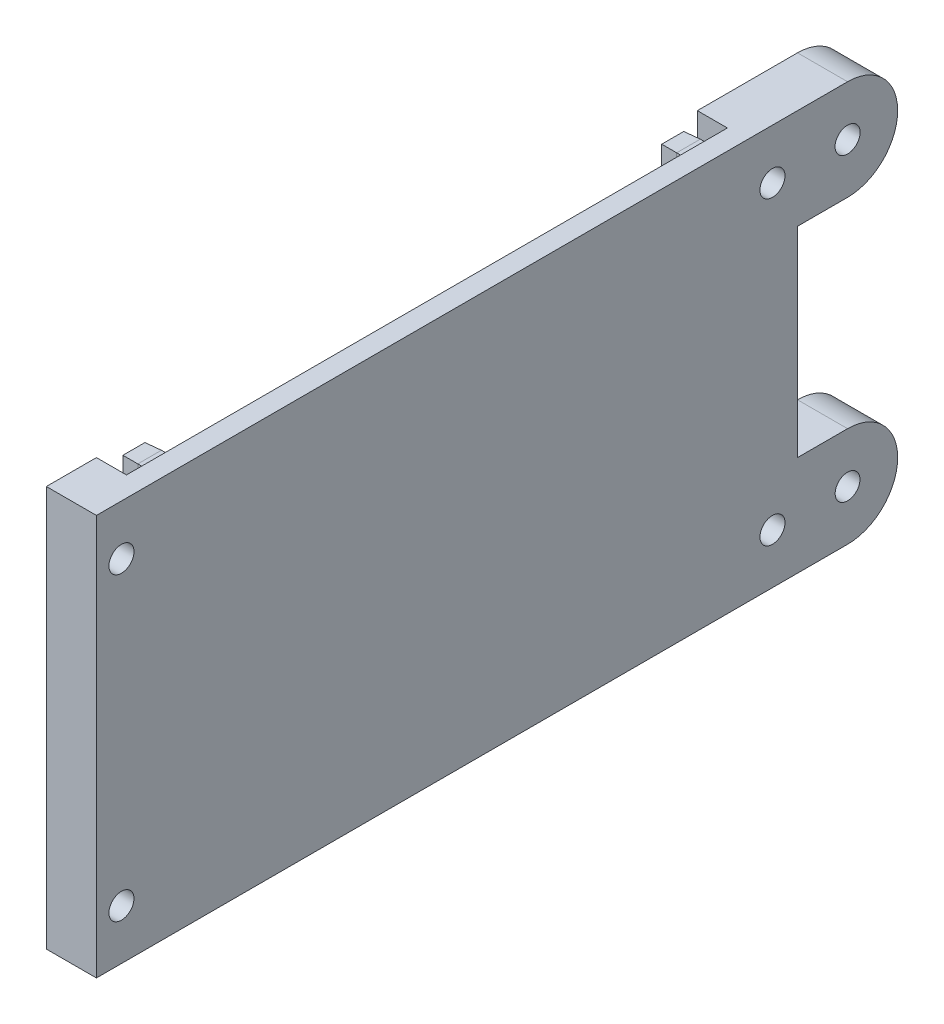
from build123d import *

# Parameters (mm, degrees)
SKETCH1_W            = 81.28
SKETCH1_H            = 81.28
SKETCH1_W_2          = 76.2
SKETCH1_H_2          = 76.2
BOSS_EXTRUDE1_DEPTH  = 50.8
SKETCH2_W            = 3.81
SKETCH2_H            = 76.2
BOSS_EXTRUDE2_DEPTH  = 2.54
SKETCH3_R            = 1.5748
BOSS_EXTRUDE3_DEPTH  = 6.35
SKETCH4_R            = 1.5875
BOSS_EXTRUDE4_DEPTH  = 6.35
SKETCH6_W            = 74.93
SKETCH6_H            = 50.8
CUT_EXTRUDE1_DEPTH   = 118.45268707
SKETCH7_W            = 2.9972
SKETCH7_H            = 6.35
BOSS_EXTRUDE5_DEPTH  = 1.00076
SKETCH8_W            = 2.9972
SKETCH8_H            = 6.35
BOSS_EXTRUDE6_DEPTH  = 1.99898
BOSS_EXTRUDE6_TAPER  = 3
LPATTERN1_COUNT      = 4
LPATTERN1_PITCH      = 12.7
LPATTERN1_COUNT_DIR2 = 2
LPATTERN1_PITCH_DIR2 = 68.326
SKETCH9_W            = 6.35
SKETCH9_H            = 50.8
BOSS_EXTRUDE7_DEPTH  = 3.81
SKETCH10_R           = 1.5875
CUT_EXTRUDE2_DEPTH   = 77.727341932
SKETCH12_W           = 4.993400043
SKETCH12_H           = 34.528830081
SKETCH12_W_2         = 6.055825583
SKETCH12_H_2         = 9.668072422
SKETCH12_H_3         = 8.28691922
CUT_EXTRUDE3_DEPTH   = 3.81
SKETCH13_W           = 6.35
SKETCH13_H           = 25.4
BOSS_EXTRUDE8_DEPTH  = 3.81
LPATTERN2_COUNT      = 2
LPATTERN2_PITCH      = 82.55


with BuildPart() as part:
    # Sketch1 → Boss-Extrude1 (new body)
    with BuildSketch(Plane(origin=(0, 0, 0), x_dir=(1, 0, 0), z_dir=(0, 1, 0))):
        Rectangle(SKETCH1_W, SKETCH1_H)
        Rectangle(SKETCH1_W_2, SKETCH1_H_2, mode=Mode.SUBTRACT)
    extrude(amount=BOSS_EXTRUDE1_DEPTH)

    # Sketch2 → Boss-Extrude2 (add)
    with BuildSketch(Plane(origin=(0, 0, 0), x_dir=(1, 0, 0), z_dir=(0, 1, 0))):
        with Locations((-36.195, 0)):
            Rectangle(SKETCH2_W, SKETCH2_H)
        with Locations((36.195, 0)):
            Rectangle(SKETCH2_W, SKETCH2_H)
    extrude(amount=BOSS_EXTRUDE2_DEPTH)

    # Sketch3 → Boss-Extrude3 (add)
    with BuildSketch(Plane(origin=(40.64, 0, 0), x_dir=(0, 0, -1), z_dir=(1, 0, 0))):
        with BuildLine():
            Line((50.8, 12.7), (40.64, 12.7))
            Line((40.64, 12.7), (40.64, 0))
            Line((40.64, 0), (50.8, 0))
            ThreePointArc((50.8, 0), (57.15, 6.35), (50.8, 12.7))
        make_face()
        with Locations((50.8, 6.35)):
            Circle(SKETCH3_R, mode=Mode.SUBTRACT)
    boss_extrude3 = extrude(amount=-BOSS_EXTRUDE3_DEPTH)

    # Sketch4 → Boss-Extrude4 (add)
    with BuildSketch(Plane(origin=(40.64, 0, 0), x_dir=(0, 0, -1), z_dir=(1, 0, 0))):
        with BuildLine():
            Line((50.8, 50.8), (40.64, 50.8))
            Line((40.64, 50.8), (40.64, 38.1))
            Line((40.64, 38.1), (50.8, 38.1))
            ThreePointArc((50.8, 38.1), (57.15, 44.45), (50.8, 50.8))
        make_face()
        with Locations((50.8, 44.45)):
            Circle(SKETCH4_R, mode=Mode.SUBTRACT)
    boss_extrude4 = extrude(amount=-BOSS_EXTRUDE4_DEPTH)

    # Mirror1: Boss-Extrude3, Boss-Extrude4 across plane
    add(boss_extrude3.mirror(Plane.ZY))
    add(boss_extrude4.mirror(Plane.ZY))

    # Sketch6 → Cut-Extrude1 (cut, through all)
    with BuildSketch(Plane.XY.offset(40.64)):
        with Locations((-3.175, 25.4)):
            Rectangle(SKETCH6_W, SKETCH6_H)
    extrude(amount=-CUT_EXTRUDE1_DEPTH, mode=Mode.SUBTRACT)

    # Sketch7 → Boss-Extrude5 (add)
    with BuildSketch(Plane.ZY.offset(-38.1)):
        with Locations((-34.16554, 9.017)):
            Rectangle(SKETCH7_W, SKETCH7_H)
    boss_extrude5 = extrude(amount=BOSS_EXTRUDE5_DEPTH)

    # Sketch8 → Boss-Extrude6 (add)
    with BuildSketch(Plane.ZY.offset(-37.09924)):
        with Locations((-34.16554, 9.017)):
            Rectangle(SKETCH8_W, SKETCH8_H)
    boss_extrude6 = extrude(amount=BOSS_EXTRUDE6_DEPTH, taper=BOSS_EXTRUDE6_TAPER)

    # LPattern1: Boss-Extrude5, Boss-Extrude6 4 × 2
    with Locations(*[(0, i * LPATTERN1_PITCH, j * LPATTERN1_PITCH_DIR2) for i in range(LPATTERN1_COUNT) for j in range(LPATTERN1_COUNT_DIR2) if (i, j) != (0, 0)]):
        add(boss_extrude5)
        add(boss_extrude6)

    # Sketch9 → Boss-Extrude7 (add)
    with BuildSketch(Plane(origin=(34.29, 50.8, 40.64), x_dir=(1, 0, 0), z_dir=(0, 0, 1))):
        with Locations((3.175, -25.4)):
            Rectangle(SKETCH9_W, SKETCH9_H)
    extrude(amount=BOSS_EXTRUDE7_DEPTH)

    # Sketch10 → Cut-Extrude2 (cut, through all)
    with BuildSketch(Plane.ZY.offset(-34.29)):
        with Locations((41.275, 44.45)):
            Circle(SKETCH10_R)
        with Locations((41.275, 6.35)):
            Circle(SKETCH10_R)
    cut_extrude2 = extrude(amount=-CUT_EXTRUDE2_DEPTH, mode=Mode.SUBTRACT)

    # Sketch12 → Cut-Extrude3 (cut)
    with BuildSketch(Plane.ZY.offset(-34.29)):
        with Locations((33.961683306, 21.990472175)):
            Rectangle(SKETCH12_W, SKETCH12_H)
        with Locations((-34.13979387, 34.420851005)):
            Rectangle(SKETCH12_W_2, SKETCH12_H_2)
        with Locations((-34.13979387, 8.869516745)):
            Rectangle(SKETCH12_W_2, SKETCH12_H_3)
    extrude(amount=-CUT_EXTRUDE3_DEPTH, mode=Mode.SUBTRACT)

    # Sketch13 → Boss-Extrude8 (add)
    with BuildSketch(Plane(origin=(0, 0, -40.64), x_dir=(-1, 0, 0), z_dir=(0, 0, -1))):
        with Locations((-37.465, 25.4)):
            Rectangle(SKETCH13_W, SKETCH13_H)
    extrude(amount=BOSS_EXTRUDE8_DEPTH)

    # LPattern2: Cut-Extrude2 ×2
    with Locations(*[(0, 0, -i * LPATTERN2_PITCH) for i in range(1, LPATTERN2_COUNT)]):
        add(cut_extrude2, mode=Mode.SUBTRACT)


solid = part.part
